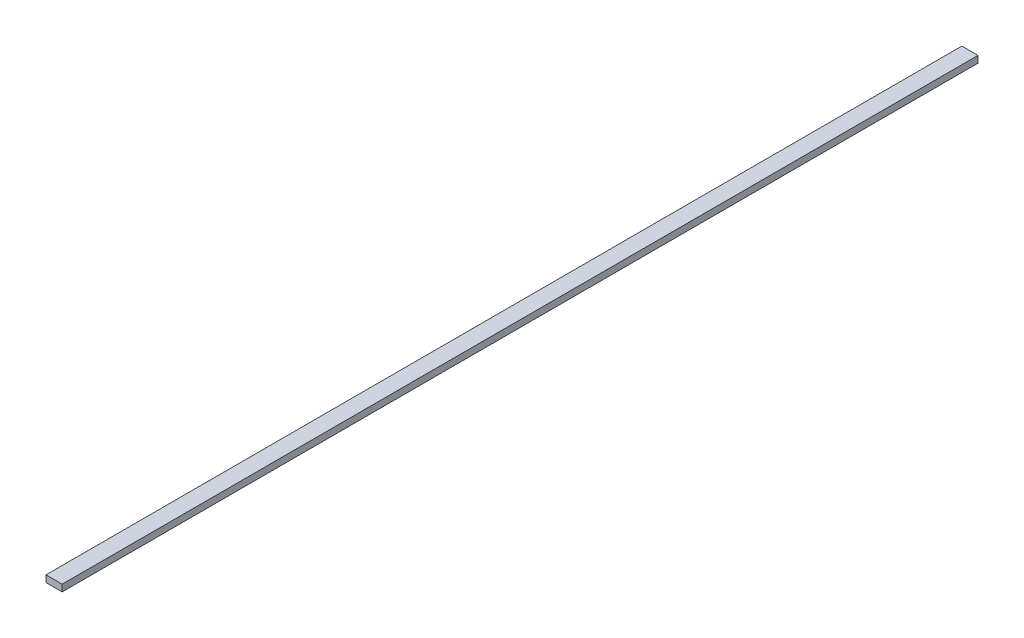
from build123d import *

# Parameters (mm, degrees)
SKIZZE1_W                       = 12
SKIZZE1_H                       = 5
AUFSATZ_LINEAR_AUSTRAGEN1_DEPTH = 680


with BuildPart() as part:
    # Skizze1 → Aufsatz-Linear austragen1 (new body)
    with BuildSketch(Plane.XY):
        with Locations((6, 2.5)):
            Rectangle(SKIZZE1_W, SKIZZE1_H)
    extrude(amount=AUFSATZ_LINEAR_AUSTRAGEN1_DEPTH)


solid = part.part
